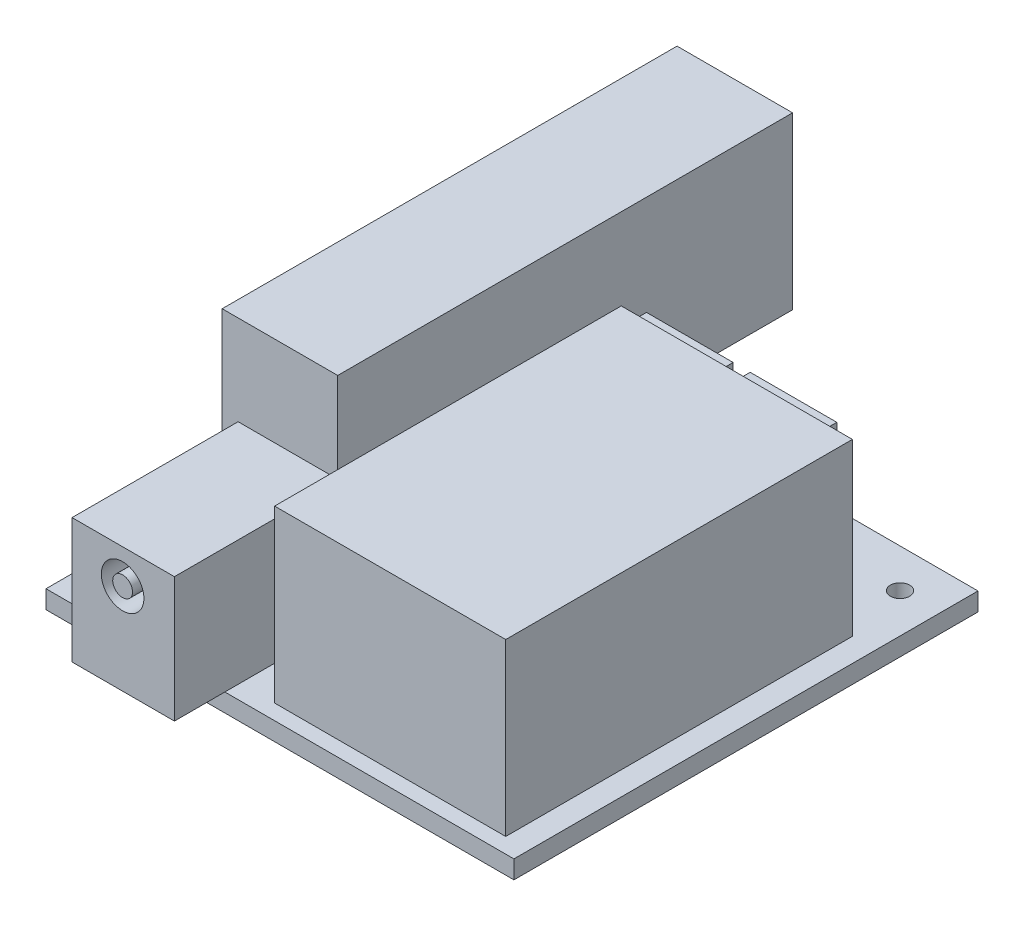
from build123d import *

# Parameters (mm, degrees)
SKETCH3_W           = 41.148121512
SKETCH3_H           = 40.81
SKETCH3_R           = 0.8508
BOSS_EXTRUDE1_DEPTH = 1.6
SKETCH4_W           = 9
SKETCH4_H           = 14.6
BOSS_EXTRUDE2_DEPTH = 11
SKETCH5_R           = 1.871357829
SKETCH5_R_2         = 0.869870556
CUT_EXTRUDE1_DEPTH  = 11
SKETCH6_W           = 20.324920815
SKETCH6_H           = 30.484920815
BOSS_EXTRUDE3_DEPTH = 15
SKETCH7_W           = 7.620985393
SKETCH7_H           = 2.54
SKETCH7_W_2         = 7.620835906
BOSS_EXTRUDE4_DEPTH = 9
SKETCH8_W           = 10.16
SKETCH8_H           = 40
BOSS_EXTRUDE5_DEPTH = 15


with BuildPart() as part:
    # Sketch3 → Boss-Extrude1 (new body)
    with BuildSketch(Plane(origin=(0, 0, 0), x_dir=(1, 0, 0), z_dir=(0, 1, 0))):
        with Locations((35.374060756, 20.505)):
            Rectangle(SKETCH3_W, SKETCH3_H)
        with Locations((18.2, 3.5)):
            Circle(SKETCH3_R, mode=Mode.SUBTRACT)
        with Locations((52.5, 37.5)):
            Circle(SKETCH3_R, mode=Mode.SUBTRACT)
        with Locations((18.2, 37.5)):
            Circle(SKETCH3_R, mode=Mode.SUBTRACT)
    extrude(amount=BOSS_EXTRUDE1_DEPTH)

    # Sketch4 → Boss-Extrude2 (add)
    with BuildSketch(Plane(origin=(0, 1.6, 0), x_dir=(1, 0, 0), z_dir=(0, 1, 0))):
        with Locations((26.028, 2.965)):
            Rectangle(SKETCH4_W, SKETCH4_H)
    extrude(amount=BOSS_EXTRUDE2_DEPTH)

    # Sketch5 → Cut-Extrude1 (cut)
    with BuildSketch(Plane.XY.offset(4.335)):
        with Locations((25.972613511, 9.593081392)):
            Circle(SKETCH5_R)
        with Locations((25.972613511, 9.593081392)):
            Circle(SKETCH5_R_2, mode=Mode.SUBTRACT)
    extrude(amount=-CUT_EXTRUDE1_DEPTH, mode=Mode.SUBTRACT)

    # Sketch6 → Boss-Extrude3 (add)
    with BuildSketch(Plane(origin=(0, 1.6, 0), x_dir=(1, 0, 0), z_dir=(0, 1, 0))):
        with Locations((43.720460407, 16.687539593)):
            Rectangle(SKETCH6_W, SKETCH6_H)
    extrude(amount=BOSS_EXTRUDE3_DEPTH)

    # Sketch7 → Boss-Extrude4 (add)
    with BuildSketch(Plane(origin=(0, 1.6, 0), x_dir=(1, 0, 0), z_dir=(0, 1, 0))):
        with Locations((32.968492697, 37.275)):
            Rectangle(SKETCH7_W, SKETCH7_H)
        with Locations((42.088417953, 37.275)):
            Rectangle(SKETCH7_W_2, SKETCH7_H)
    extrude(amount=BOSS_EXTRUDE4_DEPTH)

    # Sketch8 → Boss-Extrude5 (add)
    with BuildSketch(Plane(origin=(0, 1.6, 0), x_dir=(1, 0, 0), z_dir=(0, 1, 0))):
        with Locations((21.303, 34.17)):
            Rectangle(SKETCH8_W, SKETCH8_H)
    extrude(amount=BOSS_EXTRUDE5_DEPTH)


solid = part.part
